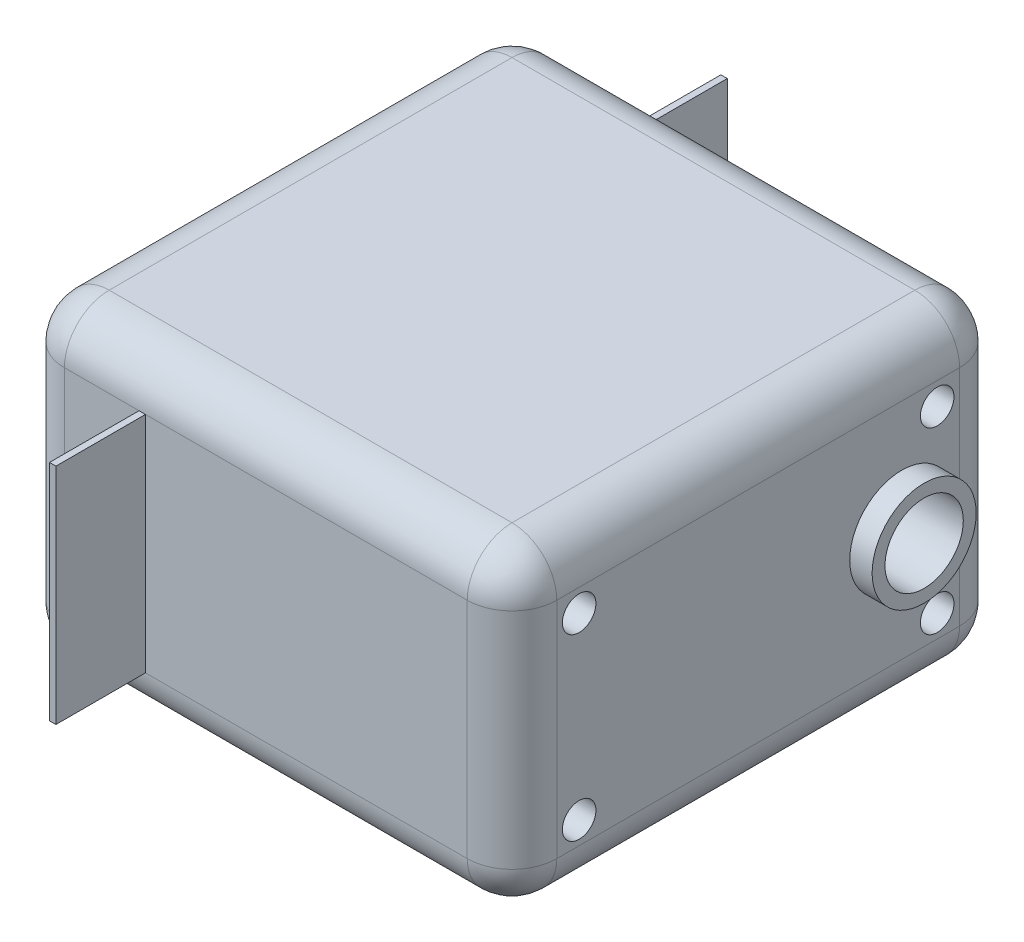
from build123d import *

# Parameters (mm, degrees)
SKETCH1_W                = 22
SKETCH1_H                = 14
BOSS_EXTRUDE1_DEPTH      = 11
FILLET1_R                = 2
SKETCH4_R                = 0.75
CUT_EXTRUDE1_DEPTH       = 28
SKETCH5_R                = 2.324910534
SKETCH5_R_2              = 1.75
BOSS_EXTRUDE2_DEPTH      = 1
CUT_EXTRUDE2_START       = -10
SKETCH5_2_R              = 1.75
CUT_EXTRUDE2_DEPTH       = 10
BOSS_EXTRUDE3_DEPTH      = 4
BOSS_EXTRUDE3_DEPTH_BACK = 26
SKETCH6_W                = 0.286837791
SKETCH6_H                = 10


with BuildPart() as part:
    # Sketch1 → Boss-Extrude1 (new, symmetric)
    with BuildSketch(Plane.XY):
        Rectangle(SKETCH1_W, SKETCH1_H)
    extrude(amount=BOSS_EXTRUDE1_DEPTH, both=True)

    # Fillet1
    fillet1_edges = [part.edges().sort_by_distance(p)[0] for p in [
        (-11, 0, 11),
        (0, -7, 11),
        (11, 0, 11),
        (0, -7, -11),
        (-11, 0, -11),
        (0, 7, -11),
        (11, 0, -11),
        (0, 7, 11),
        (11, -7, 0),
        (-11, -7, 0),
        (-11, 7, 0),
        (11, 7, 0),
    ]]
    fillet(fillet1_edges, radius=FILLET1_R)

    # Sketch4 → Cut-Extrude1 (cut)
    with BuildSketch(Plane(origin=(11, 0, 0), x_dir=(0, 0, -1), z_dir=(1, 0, 0))):
        with Locations((-8, 4)):
            Circle(SKETCH4_R)
        with Locations((-8, -4)):
            Circle(SKETCH4_R)
        with Locations((8, -4)):
            Circle(SKETCH4_R)
        with Locations((8, 4)):
            Circle(SKETCH4_R)
    extrude(amount=-CUT_EXTRUDE1_DEPTH, mode=Mode.SUBTRACT)

    # Sketch5 → Boss-Extrude2 (add)
    with BuildSketch(Plane(origin=(11, 0, 0), x_dir=(0, 0, -1), z_dir=(1, 0, 0))):
        with Locations(Location((6.416436668, 0, 0), (0, 0, 180))):
            Circle(SKETCH5_R)
        with Locations((6.416436668, 0)):
            Circle(SKETCH5_R_2, mode=Mode.SUBTRACT)
    extrude(amount=BOSS_EXTRUDE2_DEPTH)

    # Sketch5<2> → Cut-Extrude2 (cut)
    with BuildSketch(Plane(origin=(11, 0, 0), x_dir=(0, 0, -1), z_dir=(1, 0, 0)).offset(CUT_EXTRUDE2_START)):
        with Locations((6.416436668, 0)):
            Circle(SKETCH5_2_R)
    extrude(amount=CUT_EXTRUDE2_DEPTH, mode=Mode.SUBTRACT)

    # Sketch6 → Boss-Extrude3 (add, two sides: drawn at the far end of the back side and taken through both)
    with BuildSketch(Plane(origin=(0, 0, -11), x_dir=(-1, 0, 0), z_dir=(0, 0, -1)).offset(-BOSS_EXTRUDE3_DEPTH_BACK)):
        with Locations((5.523593607, 0)):
            Rectangle(SKETCH6_W, SKETCH6_H)
    extrude(amount=BOSS_EXTRUDE3_DEPTH + BOSS_EXTRUDE3_DEPTH_BACK)


solid = part.part
